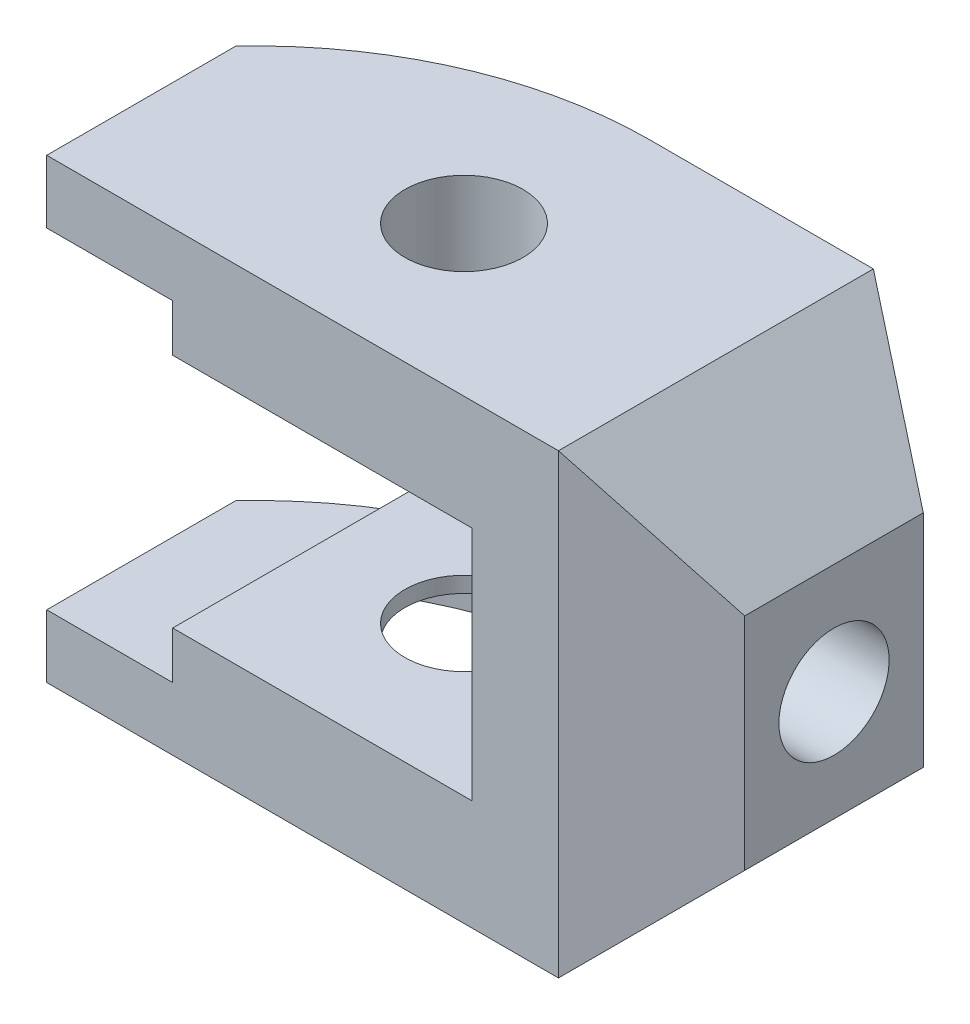
from build123d import *

# Parameters (mm, degrees)
SKETCH1_R           = 7.5
BOSS_EXTRUDE1_DEPTH = 58
SKETCH2_W           = 38
SKETCH2_H           = 30
SKETCH2_W_2         = 16
SKETCH2_H_2         = 42
CUT_EXTRUDE1_DEPTH  = 58
CUT_EXTRUDE2_DEPTH  = 58
SKETCH4_R           = 7
CUT_EXTRUDE3_DEPTH  = 108
CUT_EXTRUDE4_DEPTH  = 6
CUT_EXTRUDE5_DEPTH  = 12


with BuildPart() as part:
    # Sketch1 → Boss-Extrude1 (new body)
    with BuildSketch(Plane(origin=(0, 0, 0), x_dir=(1, 0, 0), z_dir=(0, 1, 0))):
        with BuildLine():
            Line((0, 0), (65, 0))
            Line((65, 0), (80, 8.660254038))
            Line((80, 8.660254038), (80, 31.339745962))
            Line((80, 31.339745962), (65, 40))
            Line((65, 40), (36.66060556, 40))
            ThreePointArc((36.66060556, 40), (16.66060556, 35.82575695), (0, 24))
            Line((0, 24), (0, 0))
        make_face()
        with Locations(Location((34, 19, 0), (0, 0, 90))):
            Circle(SKETCH1_R, mode=Mode.SUBTRACT)
    extrude(amount=BOSS_EXTRUDE1_DEPTH)

    # Sketch2 → Cut-Extrude1 (cut)
    with BuildSketch(Plane.XY):
        with Locations((35, 29)):
            Rectangle(SKETCH2_W, SKETCH2_H)
        with Locations((8, 29)):
            Rectangle(SKETCH2_W_2, SKETCH2_H_2)
    extrude(amount=-CUT_EXTRUDE1_DEPTH, mode=Mode.SUBTRACT)

    # Sketch3 → Cut-Extrude2 (cut)
    with BuildSketch(Plane.XY):
        Polygon((65, 58), (80, 58), (80, 43), align=None)
        Polygon((65, 0), (80, 0), (80, 15), align=None)
    extrude(amount=-CUT_EXTRUDE2_DEPTH, mode=Mode.SUBTRACT)

    # Sketch4 → Cut-Extrude3 (cut)
    with BuildSketch(Plane(origin=(0, 0, 0), x_dir=(0, 0, -1), z_dir=(1, 0, 0))):
        with Locations(Location((20, 29, 0), (0, 0, 180))):
            Circle(SKETCH4_R)
    extrude(amount=CUT_EXTRUDE3_DEPTH, mode=Mode.SUBTRACT)

    # Sketch5 → Cut-Extrude4 (cut)
    with BuildSketch(Plane(origin=(0, 0, 0), x_dir=(1, 0, 0), z_dir=(0, 1, 0))):
        with BuildLine():
            Line((0, 20.98386677), (0, 2))
            Line((0, 2), (63, 2))
            Line((63, 2), (63, 38))
            Line((63, 38), (36.66060556, 38))
            ThreePointArc((36.66060556, 38), (16.452013389, 33.538635744), (0, 20.98386677))
        make_face()
    extrude(amount=CUT_EXTRUDE4_DEPTH, mode=Mode.SUBTRACT)

    # Sketch7 → Cut-Extrude5 (cut)
    with BuildSketch(Plane(origin=(0, 0, 0), x_dir=(1, 0, 0), z_dir=(0, 1, 0))):
        with BuildLine():
            Line((18, 32.044997326), (18, 4))
            Line((18, 4), (61, 4))
            Line((61, 4), (61, 36))
            Line((61, 36), (36.66060556, 36))
            ThreePointArc((36.66060556, 36), (27.123044996, 35.000388204), (18, 32.044997326))
        make_face()
    extrude(amount=CUT_EXTRUDE5_DEPTH, mode=Mode.SUBTRACT)


solid = part.part
